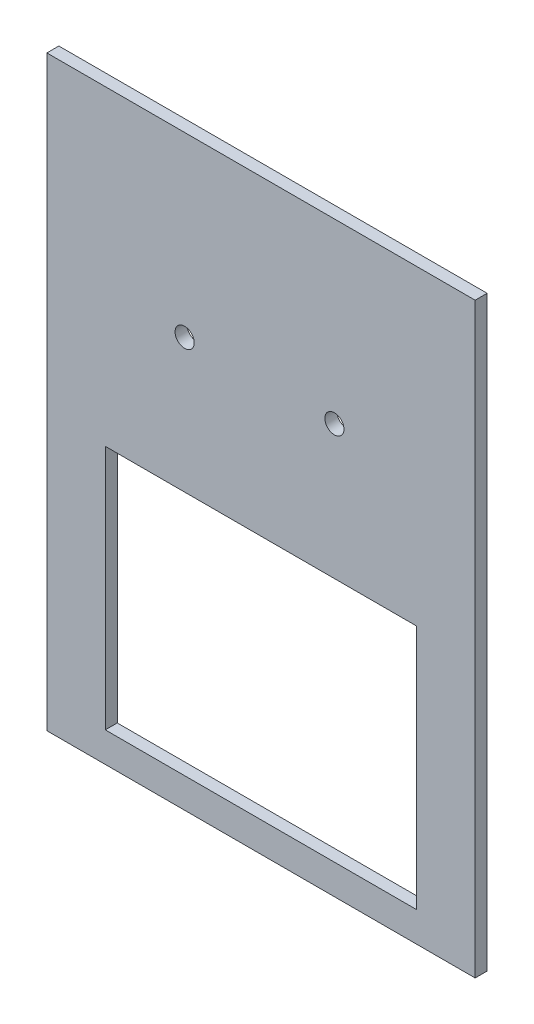
from build123d import *

# Parameters (mm, degrees)
SKETCH_1_W      = 52
SKETCH_1_H      = 41
EXTRUDE_1_DEPTH = 2
F_3_0MM_1_D     = 3.2
F_3_0MM_1_DEPTH = 2
F_3_0MM_1_TIP   = 0.96137699


with BuildPart() as part:
    # 草图1 → 凸台-拉伸1 (new body)
    with BuildSketch(Plane.XY):
        Polygon((35.75, 47.5), (35.75, 50.5), (-35.75, 50.5), (-35.75, 47.5), (-35.75, -47.5), (35.75, -47.5), align=None)
        with Locations((0, -22)):
            Rectangle(SKETCH_1_W, SKETCH_1_H, mode=Mode.SUBTRACT)
    extrude(amount=EXTRUDE_1_DEPTH)

    # Ø3.0mm 暗销孔1
    with Locations(Plane(origin=(68.159346192, -140.5, 0), x_dir=(-1, 0, 0), z_dir=(0, 0, -1))):
        with Locations((80.907068169, 161.379417443), (55.907068169, 161.379417443)):
            Hole(F_3_0MM_1_D / 2, depth=F_3_0MM_1_DEPTH)
            with Locations((0, 0, -(F_3_0MM_1_DEPTH + F_3_0MM_1_TIP / 2))):  # 118° drill point
                Cone(0, F_3_0MM_1_D / 2, F_3_0MM_1_TIP, mode=Mode.SUBTRACT)


solid = part.part
